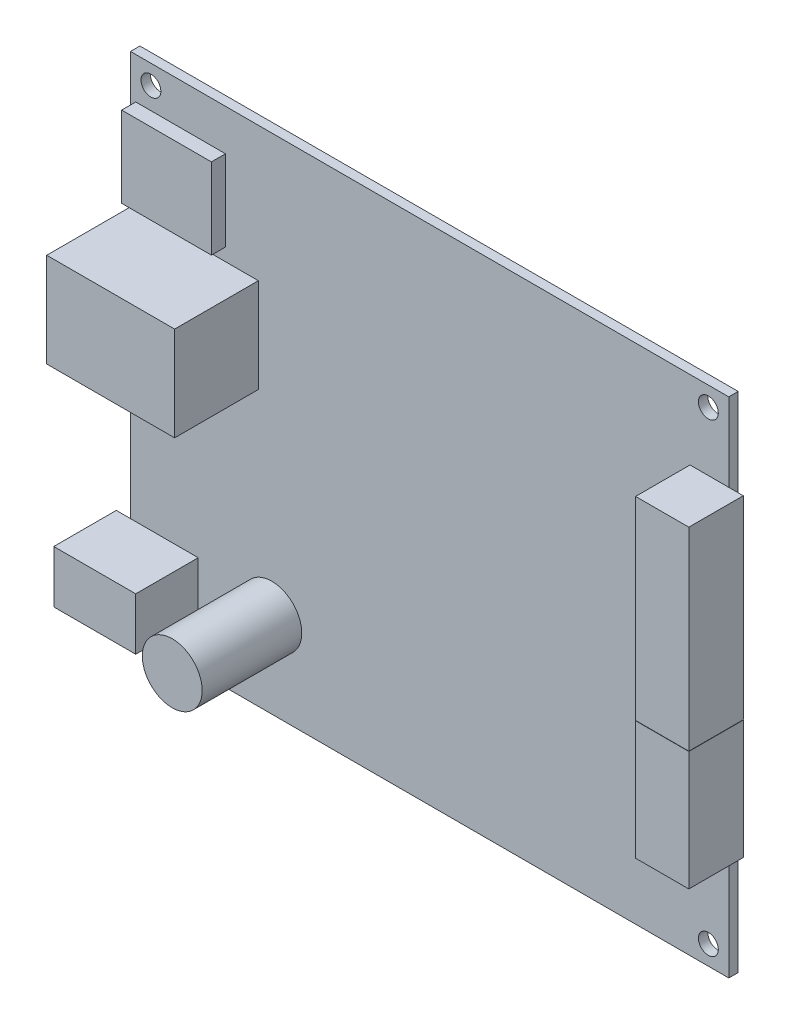
from build123d import *

# Parameters (mm, degrees)
SKETCH1_W               = 101.6
SKETCH1_H               = 85.471
BOSS_EXTRUDE1_DEPTH     = 1.6002
SKETCH2_W               = 21.717
SKETCH2_H               = 16.002
ETHERNET_DEPTH          = 14.224
SKETCH3_W               = 13.9192
SKETCH3_H               = 8.89
POWER_CONNECTOR_DEPTH   = 10.6172
SKETCH4_W               = 9.0424
SKETCH4_H               = 32.9438
SKETCH4_H_2             = 20.2184
F_2X_CONNECTOR_DEPTH    = 9.2456
SKETCH6_W               = 15.24
SKETCH6_H               = 13.716
SD_CARD_DEPTH           = 2.3876
SKETCH7_R               = 5.08
CAPACATOR_DEPTH         = 16.9164
SKETCH5_R               = 1.6891
CORNER_HOLE_DEPTH       = 71.754645263
MIRROR2_COPY_1_SKETCH_R = 1.6891
MIRROR2_COPY_1_DEPTH    = 71.754645263


with BuildPart() as part:
    # Sketch1 → Boss-Extrude1 (new body)
    with BuildSketch(Plane.XY):
        Rectangle(SKETCH1_W, SKETCH1_H)
    extrude(amount=BOSS_EXTRUDE1_DEPTH)

    # Sketch2 → Ethernet (add)
    with BuildSketch(Plane.XY.offset(1.6002)):
        with Locations((-39.9415, 11.8745)):
            Rectangle(SKETCH2_W, SKETCH2_H)
    extrude(amount=ETHERNET_DEPTH)

    # Sketch3 → Power Connector (add)
    with BuildSketch(Plane.XY.offset(1.6002)):
        with Locations((-46.2534, -30.4165)):
            Rectangle(SKETCH3_W, SKETCH3_H)
    extrude(amount=POWER_CONNECTOR_DEPTH)

    # Sketch4 → 2x Connector (add)
    with BuildSketch(Plane.XY.offset(1.6002)):
        with Locations((48.7426, 12.954)):
            Rectangle(SKETCH4_W, SKETCH4_H)
        with Locations((48.7426, -13.6779)):
            Rectangle(SKETCH4_W, SKETCH4_H_2)
    extrude(amount=F_2X_CONNECTOR_DEPTH)

    # Sketch6 → SD Card (add)
    with BuildSketch(Plane.XY.offset(1.6002)):
        with Locations((-42.291, 28.8925)):
            Rectangle(SKETCH6_W, SKETCH6_H)
    extrude(amount=SD_CARD_DEPTH)

    # Sketch7 → Capacator (add)
    with BuildSketch(Plane.XY.offset(1.6002)):
        with Locations(Location((-26.797, -28.2575, 0), (0, 0, 180))):
            Circle(SKETCH7_R)
    extrude(amount=CAPACATOR_DEPTH)

    # Sketch5 → Corner Hole (cut, through all)
    with BuildSketch(Plane(origin=(0, 0, 0), x_dir=(-1, 0, 0), z_dir=(0, 0, -1))):
        with Locations((-47.3329, 39.4462)):
            Circle(SKETCH5_R)
    corner_hole = extrude(amount=-CORNER_HOLE_DEPTH, mode=Mode.SUBTRACT)

    # Mirror1: Corner Hole across plane
    add(corner_hole.mirror(Plane(origin=(0, 0, 0), x_dir=(0, 0, 1), z_dir=(1, 0, 0))), mode=Mode.SUBTRACT)

    # Mirror2: Corner Hole across plane
    add(corner_hole.mirror(Plane.ZX), mode=Mode.SUBTRACT)

    # Mirror2 copy 1 sketch → Mirror2 copy 1 (cut, through all)
    with BuildSketch(Plane(origin=(0, 0, 0), x_dir=(1, 0, 0), z_dir=(0, 0, -1))):
        with Locations((-47.3329, 39.4462)):
            Circle(MIRROR2_COPY_1_SKETCH_R)
    extrude(amount=-MIRROR2_COPY_1_DEPTH, mode=Mode.SUBTRACT)


solid = part.part
